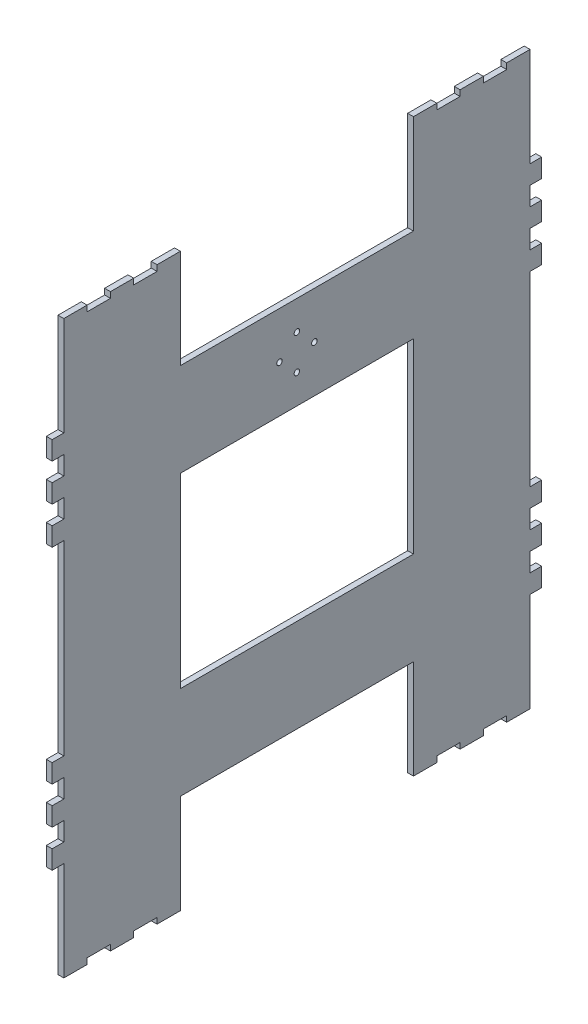
from build123d import *

# Parameters (mm, degrees)
SKETCH1_W               = 127
SKETCH1_H               = 101.6
BOSS_EXTRUDE1_DEPTH     = 3.175
CUT_EXTRUDE3_DEPTH      = 3.175
SKETCH4_W               = 6.35
SKETCH4_H               = 10.16
CUT_EXTRUDE4_DEPTH      = 3.175
MIRROR4_COPY_1_SKETCH_W = 6.35
MIRROR4_COPY_1_SKETCH_H = 10.16
MIRROR4_COPY_1_DEPTH    = 3.175


with BuildPart() as part:
    # Sketch1 → Boss-Extrude1 (new body)
    with BuildSketch(Plane(origin=(0, 0, 0), x_dir=(0, 0, -1), z_dir=(1, 0, 0))):
        Polygon((-127, -101.6), (-127, -155.575), (-114.3, -155.575), (-114.3, -152.4), (-101.6, -152.4), (-101.6, -155.575), (-88.9, -155.575), (-88.9, -152.4), (-76.2, -152.4), (-76.2, -155.575), (-63.5, -155.575), (-63.5, -101.6), (63.5, -101.6), (63.5, -155.575), (76.2, -155.575), (76.2, -152.4), (88.9, -152.4), (88.9, -155.575), (101.6, -155.575), (101.6, -152.4), (114.3, -152.4), (114.3, -155.575), (127, -155.575), (127, -101.6), (133.35, -101.6), (133.35, -50.8), (127, -50.8), (127, 50.8), (133.35, 50.8), (133.35, 101.6), (127, 101.6), (127, 155.575), (114.3, 155.575), (114.3, 152.4), (101.6, 152.4), (101.6, 155.575), (88.9, 155.575), (88.9, 152.4), (76.2, 152.4), (76.2, 155.575), (63.5, 155.575), (63.5, 101.6), (-63.5, 101.6), (-63.5, 155.575), (-76.2, 155.575), (-76.2, 152.4), (-88.9, 152.4), (-88.9, 155.575), (-101.6, 155.575), (-101.6, 152.4), (-114.3, 152.4), (-114.3, 155.575), (-127, 155.575), (-127, 101.6), (-133.35, 101.6), (-133.35, 50.8), (-127, 50.8), (-127, -50.8), (-133.35, -50.8), (-133.35, -101.6), align=None)
        Rectangle(SKETCH1_W, SKETCH1_H, mode=Mode.SUBTRACT)
    extrude(amount=BOSS_EXTRUDE1_DEPTH)

    # Sketch3 → Cut-Extrude3 (cut)
    with BuildSketch(Plane(origin=(3.175, 0, 0), x_dir=(0, 0, -1), z_dir=(1, 0, 0))):
        with BuildLine():
            Line((1.060660172, 84.639339828), (0, 85.7))
            Line((0, 85.7), (-1.060660172, 84.639339828))
            ThreePointArc((-1.060660172, 84.639339828), (0, 84.2), (1.060660172, 84.639339828))
        make_face()
        with BuildLine():
            Line((-1.060660172, 84.639339828), (0, 85.7))
            Line((0, 85.7), (1.060660172, 84.639339828))
            ThreePointArc((1.060660172, 84.639339828), (1.385819299, 85.125974851), (1.5, 85.7))
            ThreePointArc((1.5, 85.7), (-0.574025149, 87.085819299), (-1.060660172, 84.639339828))
        make_face()
        with BuildLine():
            ThreePointArc((1.060660172, 67.760660172), (0, 68.2), (-1.060660172, 67.760660172))
            Line((-1.060660172, 67.760660172), (0, 66.7))
            Line((0, 66.7), (1.060660172, 67.760660172))
        make_face()
        with BuildLine():
            Line((0, 66.7), (-1.060660172, 67.760660172))
            ThreePointArc((-1.060660172, 67.760660172), (-0.574025149, 65.314180701), (1.5, 66.7))
            ThreePointArc((1.5, 66.7), (1.385819299, 67.274025149), (1.060660172, 67.760660172))
            Line((1.060660172, 67.760660172), (0, 66.7))
        make_face()
        with BuildLine():
            ThreePointArc((11, 76.2), (10.074025149, 77.585819299), (8.439339828, 77.260660172))
            Line((8.439339828, 77.260660172), (9.5, 76.2))
            Line((9.5, 76.2), (8.439339828, 75.139339828))
            ThreePointArc((8.439339828, 75.139339828), (10.074025149, 74.814180701), (11, 76.2))
        make_face()
        with BuildLine():
            Line((9.5, 76.2), (8.439339828, 77.260660172))
            ThreePointArc((8.439339828, 77.260660172), (8, 76.2), (8.439339828, 75.139339828))
            Line((8.439339828, 75.139339828), (9.5, 76.2))
        make_face()
        with BuildLine():
            ThreePointArc((-8, 76.2), (-8.114180701, 76.774025149), (-8.439339828, 77.260660172))
            Line((-8.439339828, 77.260660172), (-9.5, 76.2))
            Line((-9.5, 76.2), (-8.439339828, 75.139339828))
            ThreePointArc((-8.439339828, 75.139339828), (-8.114180701, 75.625974851), (-8, 76.2))
        make_face()
        with BuildLine():
            Line((-9.5, 76.2), (-8.439339828, 77.260660172))
            ThreePointArc((-8.439339828, 77.260660172), (-11, 76.2), (-8.439339828, 75.139339828))
            Line((-8.439339828, 75.139339828), (-9.5, 76.2))
        make_face()
    extrude(amount=-CUT_EXTRUDE3_DEPTH, mode=Mode.SUBTRACT)

    # Sketch4 → Cut-Extrude4 (cut)
    with BuildSketch(Plane(origin=(3.175, 0, 0), x_dir=(0, 0, -1), z_dir=(1, 0, 0))):
        with Locations((130.175, 86.36)):
            Rectangle(SKETCH4_W, SKETCH4_H)
        with Locations((130.175, 66.04)):
            Rectangle(SKETCH4_W, SKETCH4_H)
    cut_extrude4 = extrude(amount=-CUT_EXTRUDE4_DEPTH, mode=Mode.SUBTRACT)

    # Mirror3: Cut-Extrude4 across plane
    add(cut_extrude4.mirror(Plane.ZX), mode=Mode.SUBTRACT)

    # Mirror4: Cut-Extrude4 across plane
    add(cut_extrude4.mirror(Plane.XY), mode=Mode.SUBTRACT)

    # Mirror4 copy 1 sketch → Mirror4 copy 1 (cut)
    with BuildSketch(Plane(origin=(3.175, 0, 0), x_dir=(0, 0, 1), z_dir=(1, 0, 0))):
        with Locations((130.175, 86.36)):
            Rectangle(MIRROR4_COPY_1_SKETCH_W, MIRROR4_COPY_1_SKETCH_H)
        with Locations((130.175, 66.04)):
            Rectangle(MIRROR4_COPY_1_SKETCH_W, MIRROR4_COPY_1_SKETCH_H)
    extrude(amount=-MIRROR4_COPY_1_DEPTH, mode=Mode.SUBTRACT)


solid = part.part
